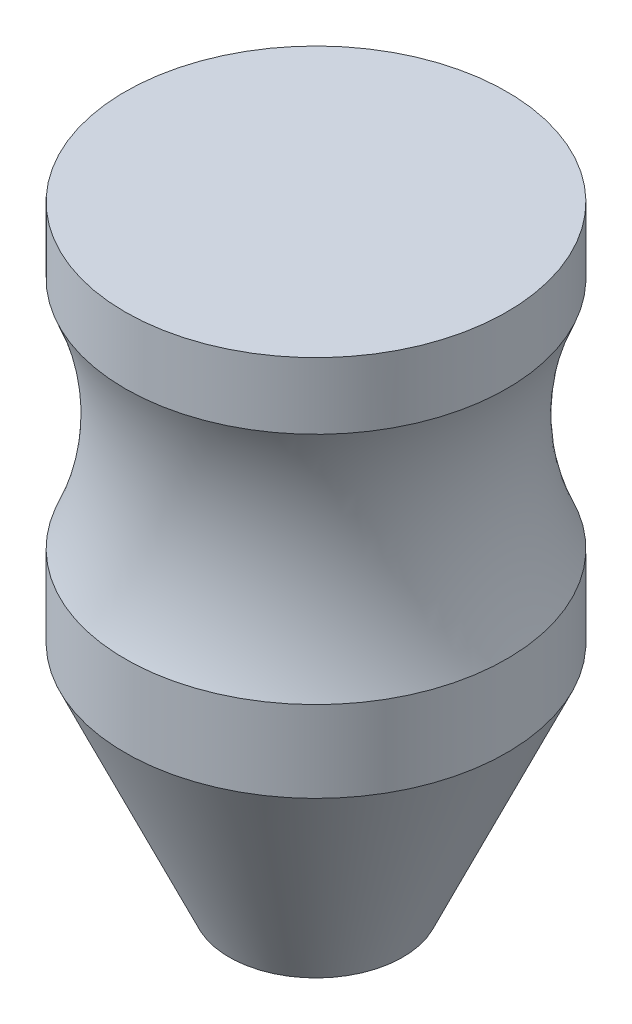
from build123d import *

# Parameters (mm, degrees)
BOSS_EXTRUDE1_DEPTH      = 50
BOSS_EXTRUDE1_DEPTH_BACK = 30
SKETCH1_R                = 25


with BuildPart() as part:
    # Sketch1 → Boss-Extrude1 (new, two sides: drawn at the far end of the back side and taken through both)
    with BuildSketch(Plane(origin=(0, 0, 0), x_dir=(1, 0, 0), z_dir=(0, 1, 0)).offset(-BOSS_EXTRUDE1_DEPTH_BACK)):
        with Locations(Location((0, 0, 0), (0, 0, 270))):
            Circle(SKETCH1_R)
    extrude(amount=BOSS_EXTRUDE1_DEPTH + BOSS_EXTRUDE1_DEPTH_BACK)

    # Sketch3 → Cut-Revolve1 (revolve, cut)
    with BuildSketch(Plane.XY, mode=Mode.PRIVATE) as cut_revolve1_sk:
        Polygon((25, 0), (11.380324124, -30), (25, -30), align=None)
    revolve(cut_revolve1_sk.sketch.rotate(Axis((0, -30, 0), (0, 1, 0)), 90), axis=Axis((0, -30, 0), (0, 1, 0)), mode=Mode.SUBTRACT)

    # Sketch4 → Cut-Revolve2 (revolve, cut)
    with BuildSketch(Plane.XY, mode=Mode.PRIVATE) as cut_revolve2_sk:
        with BuildLine():
            Line((25, 41.301516329), (25, 10.643181842))
            ThreePointArc((25, 10.643181842), (21.760985667, 25.972349086), (25, 41.301516329))
        make_face()
    revolve(cut_revolve2_sk.sketch.rotate(Axis((0, -30, 0), (0, 1, 0)), 90), axis=Axis((0, -30, 0), (0, 1, 0)), mode=Mode.SUBTRACT)


solid = part.part
